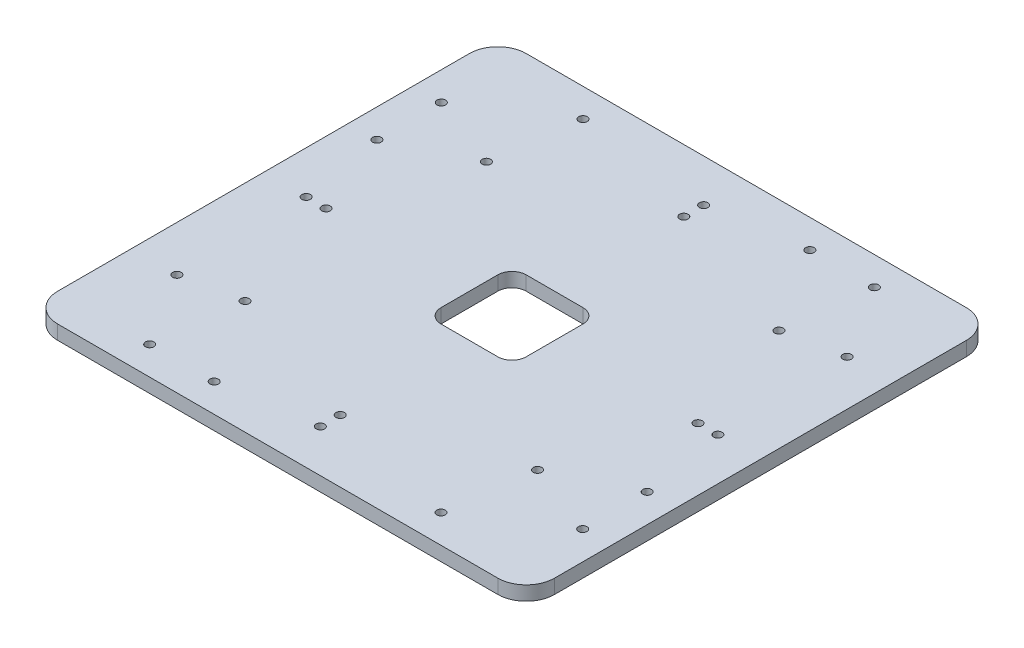
from build123d import *

# Parameters (mm, degrees)
RESSALTO_EXTRUS_O1_DEPTH = 5
ESBO_O2_R                = 1.5
CORTE_EXTRUS_O1_DEPTH    = 10
ESBO_O3_R                = 1.5
CORTE_EXTRUS_O2_DEPTH    = 15
ESBO_O4_R                = 1.5
CORTE_EXTRUS_O3_DEPTH    = 10
CORTE_EXTRUS_O4_DEPTH    = 10
ESBO_O6_R                = 1.5
CORTE_EXTRUS_O5_DEPTH    = 10


with BuildPart() as part:
    # Esboço1 → Ressalto-extrusão1 (new body)
    with BuildSketch(Plane(origin=(0, 0, 0), x_dir=(1, 0, 0), z_dir=(0, 1, 0))):
        with BuildLine():
            Line((-25.612995536, 137.664689841), (129.387004464, 137.664689841))
            ThreePointArc((129.387004464, 137.664689841), (136.458072276, 134.735757653), (139.387004464, 127.664689841))
            Line((139.387004464, 127.664689841), (139.387004464, -17.335310159))
            ThreePointArc((139.387004464, -17.335310159), (136.458072276, -24.406377971), (129.387004464, -27.335310159))
            Line((129.387004464, -27.335310159), (-25.612995536, -27.335310159))
            ThreePointArc((-25.612995536, -27.335310159), (-32.684063348, -24.406377971), (-35.612995536, -17.335310159))
            Line((-35.612995536, -17.335310159), (-35.612995536, 127.664689841))
            ThreePointArc((-35.612995536, 127.664689841), (-32.684063348, 134.735757653), (-25.612995536, 137.664689841))
        make_face()
    extrude(amount=RESSALTO_EXTRUS_O1_DEPTH)

    # Esboço2 → Corte-extrusão1 (cut)
    with BuildSketch(Plane(origin=(0, 5, 0), x_dir=(1, 0, 0), z_dir=(0, 1, 0))):
        with Locations(Location((0.387004464, 97.664689841, 0), (0, 0, 270))):
            Circle(ESBO_O2_R)
        with Locations(Location((103.387004464, 97.664689841, 0), (0, 0, 270))):
            Circle(ESBO_O2_R)
        with Locations(Location((0.387004464, 12.664689841, 0), (0, 0, 270))):
            Circle(ESBO_O2_R)
        with Locations(Location((103.387004464, 12.664689841, 0), (0, 0, 270))):
            Circle(ESBO_O2_R)
    extrude(amount=-CORTE_EXTRUS_O1_DEPTH, mode=Mode.SUBTRACT)

    # Esboço3 → Corte-extrusão2 (cut)
    with BuildSketch(Plane(origin=(0, 5, 0), x_dir=(1, 0, 0), z_dir=(0, 1, 0))):
        with Locations(Location((51.887004464, -5.335310159, 0), (0, 0, 270))):
            Circle(ESBO_O3_R)
        with Locations(Location((51.887004464, -12.335310159, 0), (0, 0, 270))):
            Circle(ESBO_O3_R)
        with Locations(Location((-20.612995536, 55.164689841, 0), (0, 0, 270))):
            Circle(ESBO_O3_R)
        with Locations(Location((-13.612995536, 55.164689841, 0), (0, 0, 270))):
            Circle(ESBO_O3_R)
        with Locations(Location((51.887004464, 122.664689841, 0), (0, 0, 90))):
            Circle(ESBO_O3_R)
        with Locations(Location((51.887004464, 115.664689841, 0), (0, 0, 90))):
            Circle(ESBO_O3_R)
        with Locations(Location((124.387004464, 55.164689841, 0), (0, 0, 90))):
            Circle(ESBO_O3_R)
        with Locations(Location((117.387004464, 55.164689841, 0), (0, 0, 90))):
            Circle(ESBO_O3_R)
    extrude(amount=-CORTE_EXTRUS_O2_DEPTH, mode=Mode.SUBTRACT)

    # Esboço4 → Corte-extrusão3 (cut)
    with BuildSketch(Plane(origin=(0, 5, 0), x_dir=(1, 0, 0), z_dir=(0, 1, 0))):
        with Locations(Location((-3.212995536, -17.335310159, 0), (0, 0, 270))):
            Circle(ESBO_O4_R)
        with Locations(Location((19.487004464, -17.335310159, 0), (0, 0, 270))):
            Circle(ESBO_O4_R)
        with Locations(Location((-25.612995536, 107.764689841, 0), (0, 0, 270))):
            Circle(ESBO_O4_R)
        with Locations(Location((-25.612995536, 85.064689841, 0), (0, 0, 270))):
            Circle(ESBO_O4_R)
        with Locations(Location((106.987004464, 127.664689841, 0), (0, 0, 270))):
            Circle(ESBO_O4_R)
        with Locations(Location((84.287004464, 127.664689841, 0), (0, 0, 270))):
            Circle(ESBO_O4_R)
        with Locations(Location((129.387004464, 2.564689841, 0), (0, 0, 270))):
            Circle(ESBO_O4_R)
        with Locations(Location((129.387004464, 25.264689841, 0), (0, 0, 270))):
            Circle(ESBO_O4_R)
    extrude(amount=-CORTE_EXTRUS_O3_DEPTH, mode=Mode.SUBTRACT)

    # Esboço5 → Corte-extrusão4 (cut)
    with BuildSketch(Plane(origin=(0, 5, 0), x_dir=(1, 0, 0), z_dir=(0, 1, 0))):
        with BuildLine():
            Line((41.887004464, 40.164689841), (61.887004464, 40.164689841))
            ThreePointArc((61.887004464, 40.164689841), (65.42253837, 41.629155935), (66.887004464, 45.164689841))
            Line((66.887004464, 45.164689841), (66.887004464, 65.164689841))
            ThreePointArc((66.887004464, 65.164689841), (65.42253837, 68.700223747), (61.887004464, 70.164689841))
            Line((61.887004464, 70.164689841), (41.887004464, 70.164689841))
            ThreePointArc((41.887004464, 70.164689841), (38.351470558, 68.700223747), (36.887004464, 65.164689841))
            Line((36.887004464, 65.164689841), (36.887004464, 45.164689841))
            ThreePointArc((36.887004464, 45.164689841), (38.351470558, 41.629155935), (41.887004464, 40.164689841))
        make_face()
    extrude(amount=-CORTE_EXTRUS_O4_DEPTH, mode=Mode.SUBTRACT)

    # Esboço6 → Corte-extrusão5 (cut)
    with BuildSketch(Plane(origin=(0, 5, 0), x_dir=(1, 0, 0), z_dir=(0, 1, 0))):
        with Locations(Location((-19.612995536, 8.664689841, 0), (0, 0, 270))):
            Circle(ESBO_O6_R)
        with Locations(Location((123.387004464, 101.664689841, 0), (0, 0, 270))):
            Circle(ESBO_O6_R)
        with Locations(Location((4.387004464, 127.664689841, 0), (0, 0, 270))):
            Circle(ESBO_O6_R)
        with Locations(Location((99.387004464, -17.335310159, 0), (0, 0, 270))):
            Circle(ESBO_O6_R)
    extrude(amount=-CORTE_EXTRUS_O5_DEPTH, mode=Mode.SUBTRACT)


solid = part.part
